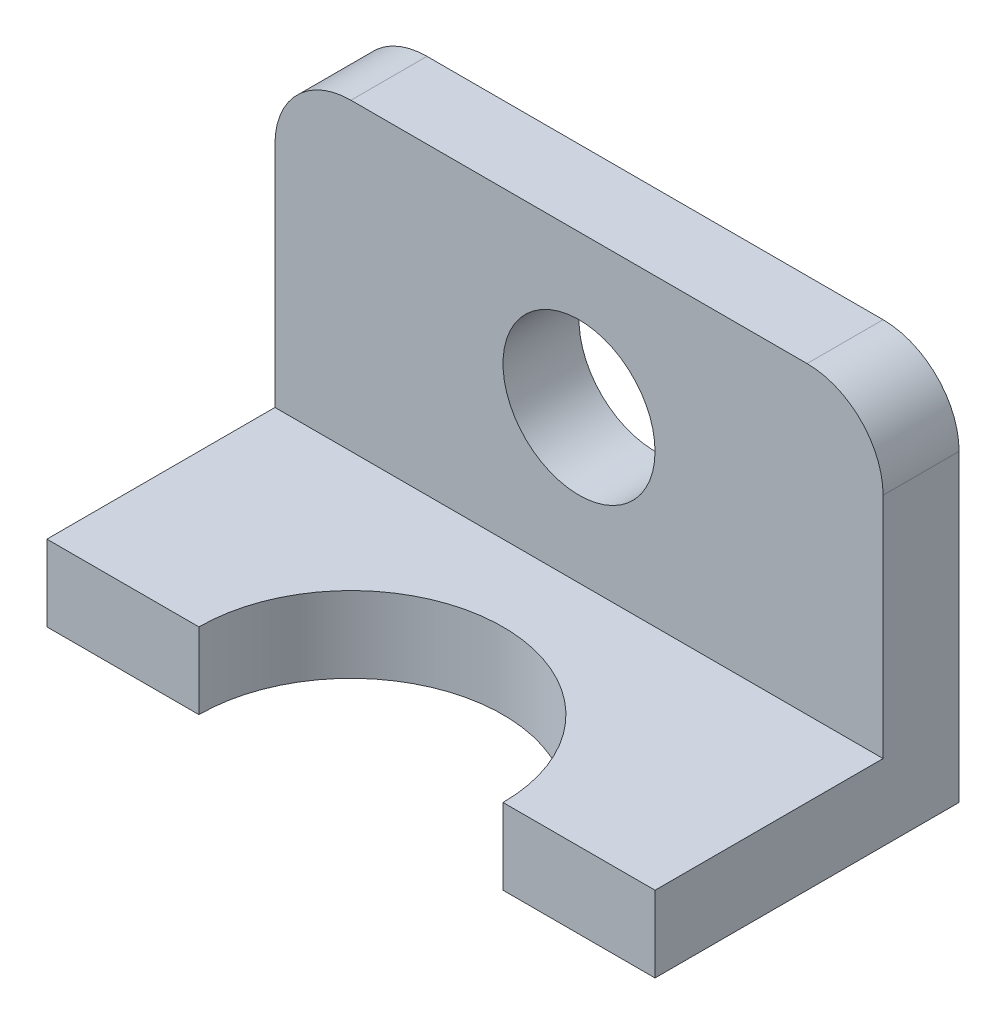
from build123d import *

# Parameters (mm, degrees)
SALIENTE_EXTRUIR1_DEPTH = 101.6
CROQUIS2_R              = 12.7
CORTAR_EXTRUIR1_DEPTH   = 101.6
CROQUIS3_R              = 25.4
CORTAR_EXTRUIR2_DEPTH   = 101.6
REDONDEO2_R             = 12.7


with BuildPart() as part:
    # Croquis1 → Saliente-Extruir1 (new body)
    with BuildSketch(Plane(origin=(0, 0, 0), x_dir=(0, 0, -1), z_dir=(1, 0, 0))):
        Polygon((0, 0), (-50.8, 0), (-50.8, 12.7), (-12.7, 12.7), (-12.7, 63.5), (0, 63.5), align=None)
    extrude(amount=SALIENTE_EXTRUIR1_DEPTH)

    # Croquis2 → Cortar-Extruir1 (cut)
    with BuildSketch(Plane.XY.offset(12.7)):
        with Locations((50.8, 38.1)):
            Circle(CROQUIS2_R)
    extrude(amount=-CORTAR_EXTRUIR1_DEPTH, mode=Mode.SUBTRACT)

    # Croquis3 → Cortar-Extruir2 (cut)
    with BuildSketch(Plane(origin=(0, 12.7, 0), x_dir=(1, 0, 0), z_dir=(0, 1, 0))):
        with Locations((50.8, -50.8)):
            Circle(CROQUIS3_R)
    extrude(amount=-CORTAR_EXTRUIR2_DEPTH, mode=Mode.SUBTRACT)

    # Redondeo2
    redondeo2_edges = [part.edges().sort_by_distance(p)[0] for p in [
        (0, 63.5, 6.35),
        (101.6, 63.5, 6.35),
    ]]
    fillet(redondeo2_edges, radius=REDONDEO2_R)


solid = part.part
